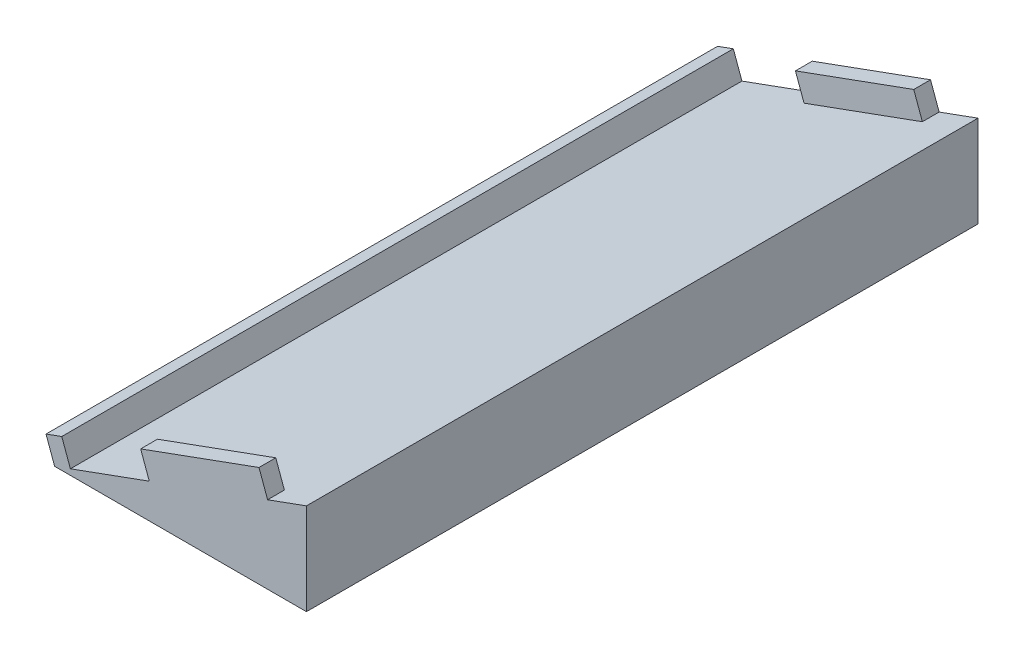
from build123d import *

# Parameters (mm, degrees)
BOSS_EXTRUDE1_DEPTH = 80
SKETCH2_W           = 2
SKETCH2_H           = 80
SKETCH2_W_2         = 15
SKETCH2_H_2         = 2
BOSS_EXTRUDE2_DEPTH = 3


with BuildPart() as part:
    # Sketch1 → Boss-Extrude1 (new body)
    with BuildSketch(Plane.XY):
        Polygon((0, 0), (30, 0), (30, 10.919107028), align=None)
    extrude(amount=BOSS_EXTRUDE1_DEPTH)

    # Sketch2 → Boss-Extrude2 (add)
    with BuildSketch(Plane(origin=(0, 0, 0), x_dir=(0.9396926207859082, 0.34202014332566943, 0), z_dir=(-0.34202014332566943, 0.9396926207859082, 0))):
        with Locations((1, -40)):
            Rectangle(SKETCH2_W, SKETCH2_H)
        with Locations((19.5, -1)):
            Rectangle(SKETCH2_W_2, SKETCH2_H_2)
        with Locations((19.5, -79)):
            Rectangle(SKETCH2_W_2, SKETCH2_H_2)
    extrude(amount=BOSS_EXTRUDE2_DEPTH)


solid = part.part
